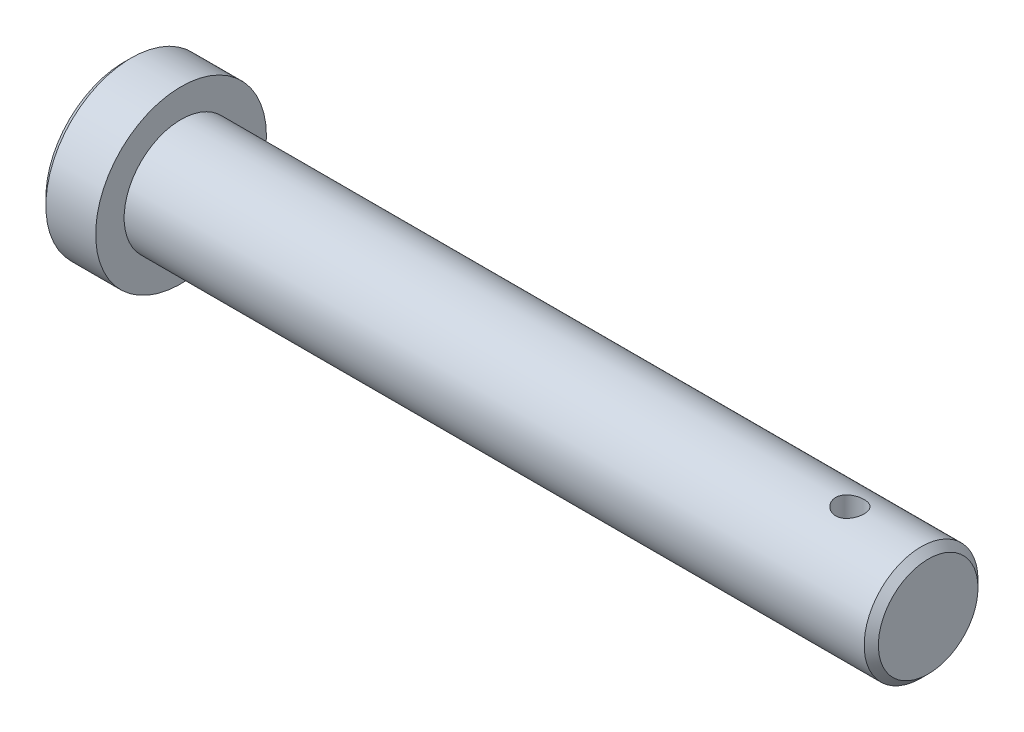
from build123d import *

# Parameters (mm, degrees)
SKETCH1_R               = 12
BOSS_EXTRUDE1_DEPTH     = 8
CHAMFER1_SIZE           = 1
SKETCH2_R               = 8
BOSS_EXTRUDE2_DEPTH     = 105
CHAMFER2_SIZE           = 1
CUT_EXTRUDE1_DEPTH      = 115.267230648
CUT_EXTRUDE1_DEPTH_BACK = 115.267230648
SKETCH3_R               = 2


with BuildPart() as part:
    # Sketch1 → Boss-Extrude1 (new body)
    with BuildSketch(Plane(origin=(0, 0, 0), x_dir=(0, 0, -1), z_dir=(1, 0, 0))):
        Circle(SKETCH1_R)
    extrude(amount=BOSS_EXTRUDE1_DEPTH)

    # Chamfer1
    chamfer1_edges = [part.edges().sort_by_distance(p)[0] for p in [
        (0, 0, 12),
    ]]
    chamfer(chamfer1_edges, length=CHAMFER1_SIZE)

    # Sketch2 → Boss-Extrude2 (add)
    with BuildSketch(Plane(origin=(8, 0, 0), x_dir=(0, 0, -1), z_dir=(1, 0, 0))):
        Circle(SKETCH2_R)
    extrude(amount=BOSS_EXTRUDE2_DEPTH)

    # Chamfer2
    chamfer2_edges = [part.edges().sort_by_distance(p)[0] for p in [
        (113, 0, 8),
    ]]
    chamfer(chamfer2_edges, length=CHAMFER2_SIZE)

    # Sketch3 → Cut-Extrude1 (cut, two sides: drawn at the far end of the back side and taken through both)
    with BuildSketch(Plane(origin=(0, 0, 0), x_dir=(1, 0, 0), z_dir=(0, 1, 0)).offset(-CUT_EXTRUDE1_DEPTH_BACK)):
        with Locations(Location((102, 0, 0), (0, 0, 270))):
            Circle(SKETCH3_R)
    extrude(amount=CUT_EXTRUDE1_DEPTH + CUT_EXTRUDE1_DEPTH_BACK, mode=Mode.SUBTRACT)


solid = part.part
